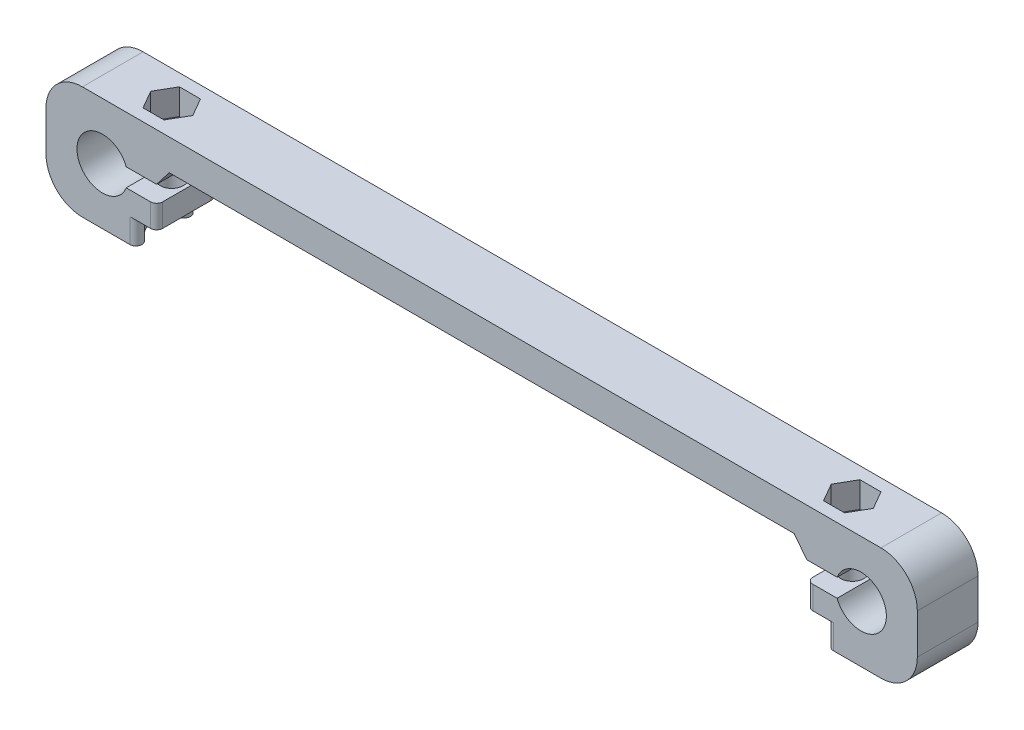
from build123d import *

# Parameters (mm, degrees)
SALIENTE_EXTRUIR1_DEPTH = 10
CROQUIS2_R              = 1.9
CORTAR_EXTRUIR1_DEPTH   = 25
CORTAR_EXTRUIR5_DEPTH   = 74.087139772
CROQUIS8_W              = 5.376990951
CROQUIS8_H              = 7.8
CORTAR_EXTRUIR6_DEPTH   = 74.087139772
CORTAR_EXTRUIR7_DEPTH   = 4.25
CROQUIS10_R             = 1.9
CORTAR_EXTRUIR8_DEPTH   = 4
REDONDEO1_R             = 1
CROQUIS11_W             = 41.47
CROQUIS11_H             = 14
CORTAR_EXTRUIR9_DEPTH   = 1.2
REDONDEO2_R             = 0.2


with BuildPart() as part:
    # Croquis1 → Saliente-Extruir1 (new body)
    with BuildSketch(Plane.XY):
        with BuildLine():
            Line((65.8, 9.3), (-65.8, 9.3))
            ThreePointArc((-65.8, 9.3), (-70.042640687, 7.542640687), (-71.8, 3.3))
            Line((-71.8, 3.3), (-71.8, -3.3))
            ThreePointArc((-71.8, -3.3), (-70.042640687, -7.542640687), (-65.8, -9.3))
            Line((-65.8, -9.3), (-48.2, -9.3))
            Line((-48.2, -9.3), (-48.2, -1.5))
            Line((-48.2, -1.5), (-58.576990951, -1.5))
            ThreePointArc((-58.576990951, -1.5), (-66.7, 0), (-58.576990951, 1.5))
            Line((-58.576990951, 1.5), (-46.2, 1.5))
            Line((-46.2, 1.5), (-46.2, -9.3))
            Line((-46.2, -9.3), (46.2, -9.3))
            Line((46.2, -9.3), (46.2, 1.5))
            Line((46.2, 1.5), (58.576990951, 1.5))
            ThreePointArc((58.576990951, 1.5), (63.26268014, 4.130171789), (66.7, 0))
            ThreePointArc((66.7, 0), (63.26268014, -4.130171789), (58.576990951, -1.5))
            Line((58.576990951, -1.5), (48.2, -1.5))
            Line((48.2, -1.5), (48.2, -9.3))
            Line((48.2, -9.3), (65.8, -9.3))
            ThreePointArc((65.8, -9.3), (70.042640687, -7.542640687), (71.8, -3.3))
            Line((71.8, -3.3), (71.8, 3.3))
            ThreePointArc((71.8, 3.3), (70.042640687, 7.542640687), (65.8, 9.3))
        make_face()
    extrude(amount=SALIENTE_EXTRUIR1_DEPTH)

    # Croquis2 → Cortar-Extruir1 (cut, symmetric)
    with BuildSketch(Plane.XZ.offset(-1.5)):
        with Locations(Location((-56.076990951, 5, 0), (0, 0, 180))):
            Circle(CROQUIS2_R)
        with Locations(Location((56.076990951, 5, 0), (0, 0, 180))):
            Circle(CROQUIS2_R)
    extrude(amount=CORTAR_EXTRUIR1_DEPTH, both=True, mode=Mode.SUBTRACT)

    # Croquis7 → Cortar-Extruir5 (cut, through all)
    with BuildSketch(Plane(origin=(0, 0, 0), x_dir=(-1, 0, 0), z_dir=(0, 0, -1))):
        Polygon((51.5, 4.2), (53.576990951, 1.5), (46.2, 1.5), (46.2, -9.3), (-46.2, -9.3), (-46.2, 1.5), (-53.576990951, 1.5), (-51.5, 4.2), align=None)
    extrude(amount=-CORTAR_EXTRUIR5_DEPTH, mode=Mode.SUBTRACT)

    # Croquis8 → Cortar-Extruir6 (cut, through all)
    with BuildSketch(Plane(origin=(0, 0, 0), x_dir=(-1, 0, 0), z_dir=(0, 0, -1))):
        with Locations((50.888495476, -5.4)):
            Rectangle(CROQUIS8_W, CROQUIS8_H)
        with Locations((-50.888495476, -5.4)):
            Rectangle(CROQUIS8_W, CROQUIS8_H)
    extrude(amount=-CORTAR_EXTRUIR6_DEPTH, mode=Mode.SUBTRACT)

    # Croquis5 → Cortar-Extruir7 (cut)
    with BuildSketch(Plane(origin=(0, 9.3, 0), x_dir=(1, 0, 0), z_dir=(0, 1, 0))):
        Polygon((-52.612889336, -5), (-54.344940143, -2), (-57.809041758, -2), (-59.541092566, -5), (-57.809041758, -8), (-54.344940143, -8), align=None)
        Polygon((59.541092566, -5), (57.809041758, -2), (54.344940143, -2), (52.612889336, -5), (54.344940143, -8), (57.809041758, -8), align=None)
    extrude(amount=-CORTAR_EXTRUIR7_DEPTH, mode=Mode.SUBTRACT)

    # Croquis10 → Cortar-Extruir8 (cut)
    # profile 1 of 2: a face of its own
    with BuildSketch(Plane.XZ.offset(9.3)):
        with BuildLine():
            Line((-53.576990951, 10), (-55.566305742, 10))
            Line((-55.566305742, 10), (-58.321648346, 7.244657395))
            ThreePointArc((-58.321648346, 7.244657395), (-59.251415882, 5), (-58.321648346, 2.755342605))
            Line((-58.321648346, 2.755342605), (-55.566305742, 0))
            Line((-55.566305742, 0), (-53.576990951, 0))
            Line((-53.576990951, 0), (-53.576990951, 10))
        make_face()
        with Locations((-56.076990951, 5)):
            Circle(CROQUIS10_R, mode=Mode.SUBTRACT)
    # profile 2 of 2: a face of its own
    with BuildSketch(Plane.XZ.offset(9.3)):
        with BuildLine():
            Line((58.321648346, 7.244657395), (55.566305742, 10))
            Line((55.566305742, 10), (53.576990951, 10))
            Line((53.576990951, 10), (53.576990951, 0))
            Line((53.576990951, 0), (55.566305742, 0))
            Line((55.566305742, 0), (58.321648346, 2.755342605))
            ThreePointArc((58.321648346, 2.755342605), (59.251415882, 5), (58.321648346, 7.244657395))
        make_face()
        with Locations((56.076990951, 5)):
            Circle(CROQUIS10_R, mode=Mode.SUBTRACT)
    extrude(amount=-CORTAR_EXTRUIR8_DEPTH, mode=Mode.SUBTRACT)

    # Redondeo1
    redondeo1_edges = [part.edges().sort_by_distance(p)[0] for p in [
        (53.576990951, -3.4, 10),
        (53.576990951, -3.4, 0),
        (-53.576990951, -3.4, 0),
        (-53.576990951, -3.4, 10),
        (-55.566305742, -7.3, 0),
        (-55.566305742, -7.3, 10),
        (55.566305742, -7.3, 0),
        (55.566305742, -7.3, 10),
    ]]
    fillet(redondeo1_edges, radius=REDONDEO1_R)

    # Croquis11 → Cortar-Extruir9 (cut)
    with BuildSketch(Plane.XZ.offset(-4.2)):
        Rectangle(CROQUIS11_W, CROQUIS11_H)
    extrude(amount=-CORTAR_EXTRUIR9_DEPTH, mode=Mode.SUBTRACT)

    # Redondeo2
    redondeo2_edges = [part.edges().sort_by_distance(p)[0] for p in [
        (20.735, 4.2, 3.5),
        (-20.735, 4.2, 3.5),
        (0, 4.2, 7),
        (-20.735, 4.8, 0),
        (20.735, 4.8, 0),
    ]]
    fillet(redondeo2_edges, radius=REDONDEO2_R)


solid = part.part
